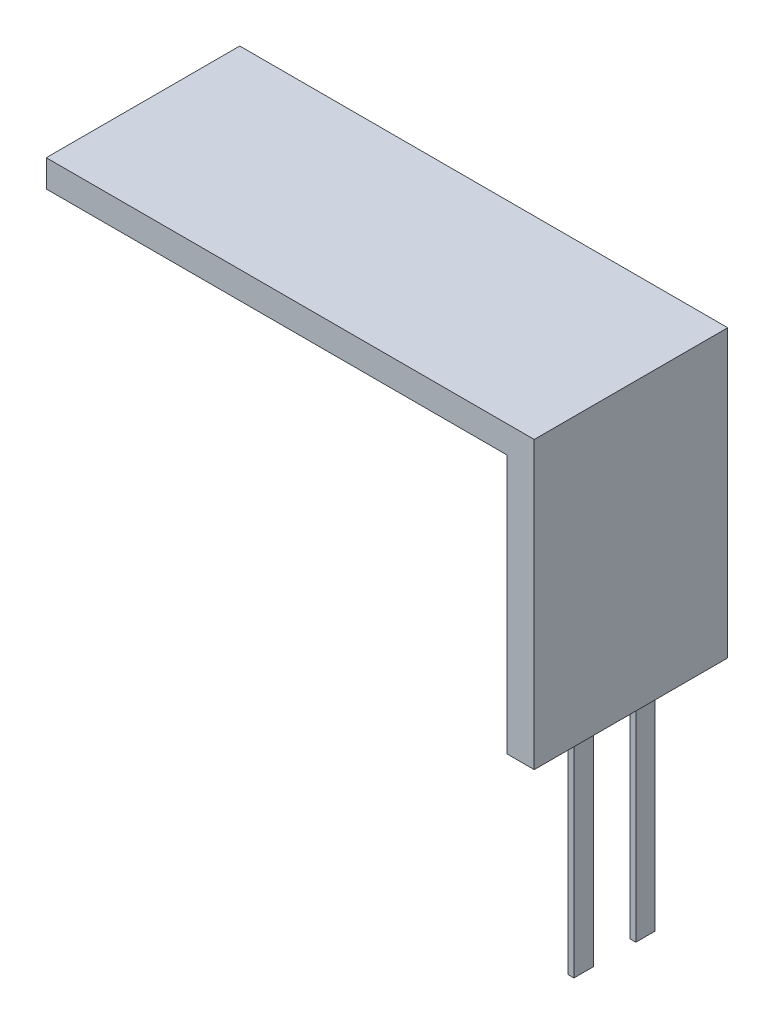
from build123d import *

# Parameters (mm, degrees)
SKETCH1_W                    = 0.15
SKETCH1_H                    = 0.5
LEGS_DEPTH                   = 6.1
LEGS_2_DEPTH                 = 6.1
FILM_START                   = 5.6
SKETCH2_W                    = 0.7
SKETCH2_H                    = 5
FILM_UP_THE_CELL_SIDE_DEPTH  = 7.39
FILM_START_2                 = 12.29
SKETCH3_W                    = 11.91
SKETCH3_H                    = 5
FILM_BETWEEN_THE_CELLS_DEPTH = 0.7


with BuildPart() as part:
    # Sketch1 → Legs (new body)
    with BuildSketch(Plane(origin=(0, 0, 0), x_dir=(1, 0, 0), z_dir=(0, 1, 0))):
        with Locations((0, 0.8)):
            Rectangle(SKETCH1_W, SKETCH1_H)
    extrude(amount=LEGS_DEPTH)



with BuildPart() as body_2:
    # Sketch1 → Legs 2 (new body)
    with BuildSketch(Plane(origin=(0, 0, 0), x_dir=(1, 0, 0), z_dir=(0, 1, 0))):
        with Locations((0, -0.8)):
            Rectangle(SKETCH1_W, SKETCH1_H)
    extrude(amount=LEGS_2_DEPTH)


with BuildPart() as part_1:
    add(part.part)

    add(body_2.part)  # Film up the cell side merges body 2
    # Sketch2 → Film up the cell side (add)
    with BuildSketch(Plane(origin=(0, 0, 0), x_dir=(1, 0, 0), z_dir=(0, 1, 0)).offset(FILM_START)):
        with Locations((0.15, 0)):
            Rectangle(SKETCH2_W, SKETCH2_H)
    extrude(amount=FILM_UP_THE_CELL_SIDE_DEPTH)

    # Sketch3 → Film between the cells (add)
    with BuildSketch(Plane(origin=(0, 0, 0), x_dir=(1, 0, 0), z_dir=(0, 1, 0)).offset(FILM_START_2)):
        with Locations((-6.155, 0)):
            Rectangle(SKETCH3_W, SKETCH3_H)
    extrude(amount=FILM_BETWEEN_THE_CELLS_DEPTH)


solid = part_1.part
